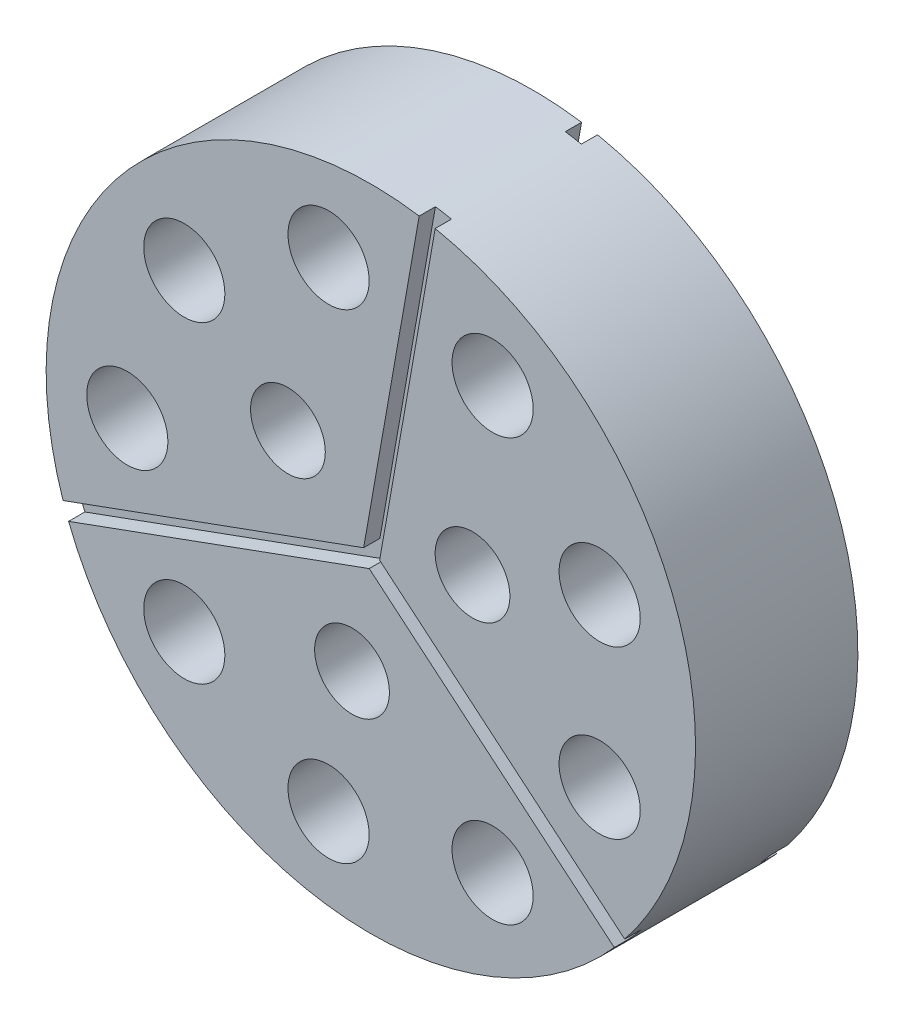
from build123d import *

# Parameters (mm, degrees)
SKETCH1_R           = 20
BOSS_EXTRUDE1_DEPTH = 10
SKETCH2_R           = 2.5
SKETCH2_R_2         = 2.302418505
CUT_EXTRUDE1_DEPTH  = 35
CUT_EXTRUDE2_START  = -1
CUT_EXTRUDE2_DEPTH  = 1


with BuildPart() as part:
    # Sketch1 → Boss-Extrude1 (new body)
    with BuildSketch(Plane.XY):
        Circle(SKETCH1_R)
    extrude(amount=BOSS_EXTRUDE1_DEPTH)

    # Sketch2 → Cut-Extrude1 (cut)
    with BuildSketch(Plane.XY.offset(10)):
        with Locations((-15, 0)):
            Circle(SKETCH2_R)
        with Locations((-11.490666647, 9.641814145)):
            Circle(SKETCH2_R)
        with Locations((-2.604722665, 14.772116295)):
            Circle(SKETCH2_R)
        with Locations((7.5, 12.990381057)):
            Circle(SKETCH2_R)
        with Locations((14.095389312, 5.13030215)):
            Circle(SKETCH2_R)
        with Locations((14.095389312, -5.13030215)):
            Circle(SKETCH2_R)
        with Locations((7.5, -12.990381057)):
            Circle(SKETCH2_R)
        with Locations((-2.604722665, -14.772116295)):
            Circle(SKETCH2_R)
        with Locations((-11.490666647, -9.641814145)):
            Circle(SKETCH2_R)
        with Locations((-5.106965508, 4.285252874)):
            Circle(SKETCH2_R_2)
        with Locations((6.264620604, 2.280135429)):
            Circle(SKETCH2_R_2)
        with Locations((-1.157655097, -6.565388303)):
            Circle(SKETCH2_R_2)
    extrude(amount=-CUT_EXTRUDE1_DEPTH, mode=Mode.SUBTRACT)

    # Sketch3 → Cut-Extrude2 (cut)
    with BuildSketch(Plane.XY.offset(10).offset(CUT_EXTRUDE2_START)):
        with BuildLine():
            ThreePointArc((-18.958988491, -6.368418596), (-18.793852416, -6.840402867), (-18.616968347, -7.308111217))
            Line((-18.616968347, -7.308111217), (-0.100255822, -0.568579021))
            Line((-0.100255822, -0.568579021), (14.994706531, -13.234756365))
            ThreePointArc((14.994706531, -13.234756365), (15.320888862, -12.855752194), (15.637494141, -12.468711922))
            Line((15.637494141, -12.468711922), (0.542531788, 0.197465422))
            Line((0.542531788, 0.197465422), (3.964281959, 19.603174961))
            ThreePointArc((3.964281959, 19.603174961), (3.472963553, 19.69615506), (2.979474206, 19.776823139))
            Line((2.979474206, 19.776823139), (-0.442275965, 0.371113599))
            Line((-0.442275965, 0.371113599), (-18.958988491, -6.368418596))
        make_face()
    cut_extrude2 = extrude(amount=CUT_EXTRUDE2_DEPTH, mode=Mode.SUBTRACT)

    # Mirror1: Cut-Extrude2 across plane
    add(cut_extrude2.mirror(Plane(origin=(0, 0, 5), x_dir=(1, 0, 0), z_dir=(0, 0, -1))), mode=Mode.SUBTRACT)


solid = part.part
